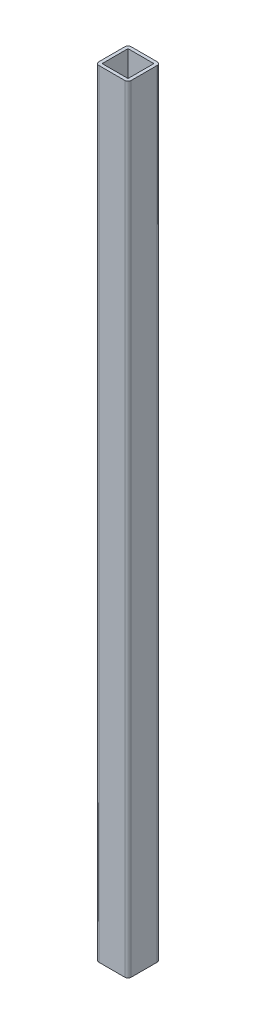
from build123d import *

# Parameters (mm, degrees)
SKETCH4_W           = 25.4
SKETCH4_H           = 25.4
BOSS_EXTRUDE6_DEPTH = 609.6
SHELL1_T            = -2.54
FILLET1_R           = 2.54


with BuildPart() as part:
    # Sketch4 → Boss-Extrude6 (new body)
    with BuildSketch(Plane(origin=(0, 0, 0), x_dir=(1, 0, 0), z_dir=(0, 1, 0))):
        Rectangle(SKETCH4_W, SKETCH4_H)
    extrude(amount=BOSS_EXTRUDE6_DEPTH)

    # Shell1
    shell1_openings = [part.faces().sort_by_distance(p)[0] for p in [
        (0, 609.6, 0),
        (0, 0, 0),
    ]]
    offset(amount=SHELL1_T, openings=shell1_openings, kind=Kind.INTERSECTION)

    # Fillet1
    fillet1_edges = [part.edges().sort_by_distance(p)[0] for p in [
        (12.7, 304.8, -12.7),
        (12.7, 304.8, 12.7),
        (-12.7, 304.8, 12.7),
        (-12.7, 304.8, -12.7),
    ]]
    fillet(fillet1_edges, radius=FILLET1_R)


solid = part.part
